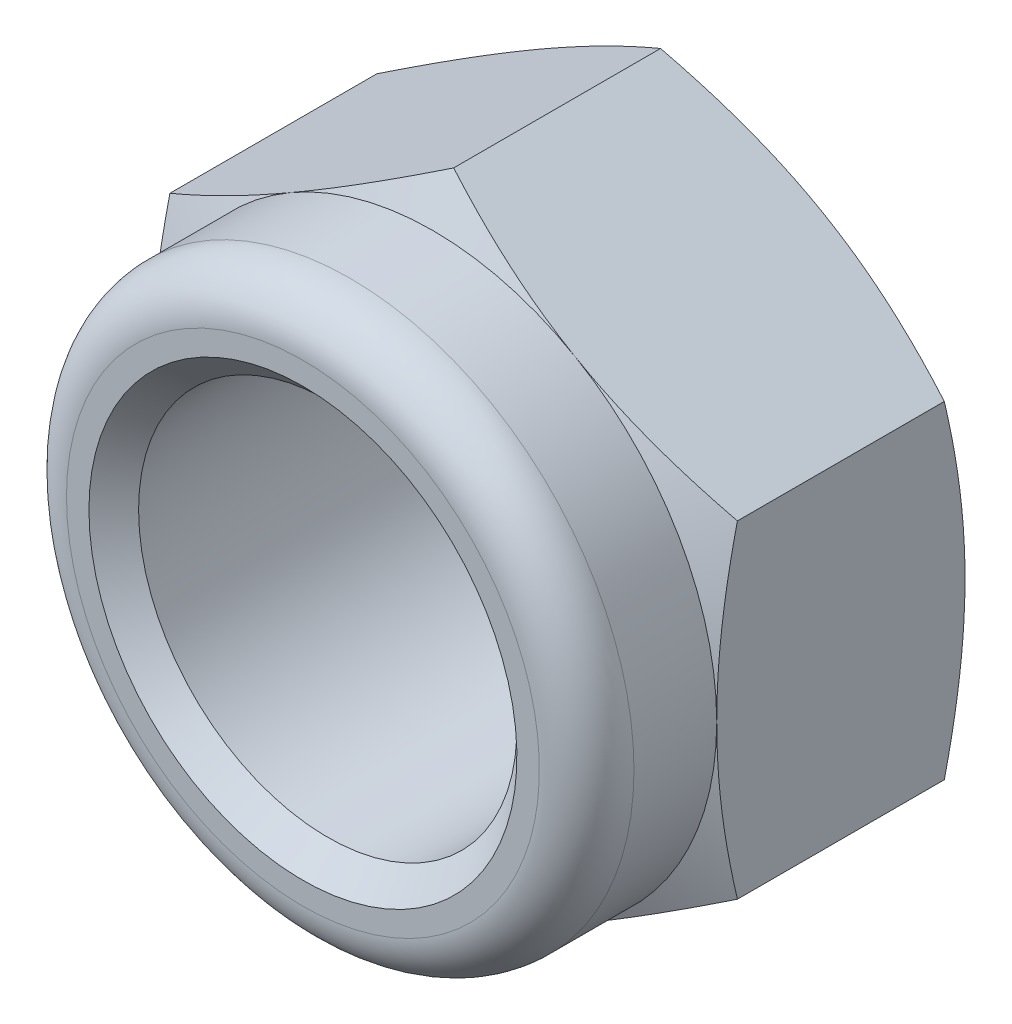
from build123d import *

# Parameters (mm, degrees)
SKETCH1_R           = 8
BOSS_EXTRUDE1_DEPTH = 10.5


with BuildPart() as part:
    # Sketch1 → Boss-Extrude1 (new body)
    with BuildSketch(Plane.XY):
        Polygon((0, -13.856406461), (12, -6.92820323), (12, 6.92820323), (0, 13.856406461), (-12, 6.92820323), (-12, -6.92820323), align=None)
        with Locations(Location((0, 0, 0), (0, 0, 180))):
            Circle(SKETCH1_R, mode=Mode.SUBTRACT)
    extrude(amount=BOSS_EXTRUDE1_DEPTH)

    # Sketch3 → Revolve1 (revolve)
    with BuildSketch(Plane(origin=(0, 0, 0), x_dir=(0, 0, -1), z_dir=(0, 1, 0))):
        with BuildLine():
            Line((-10.5, 12), (-14, 12))
            ThreePointArc((-14, 12), (-15.414213562, 11.414213562), (-16, 10))
            Line((-16, 10), (-16, 8))
            Line((-16, 8), (-10.5, 8))
            Line((-10.5, 8), (-10.5, 12))
        make_face()
    revolve(axis=Axis((0, 0, 0), (0, 0, 1)))

    # Sketch2 → Cut-Revolve1 (revolve, cut)
    with BuildSketch(Plane(origin=(0, 0, 0), x_dir=(0, 0, -1), z_dir=(1, 0, 0)), mode=Mode.PRIVATE) as cut_revolve1_sk:
        Polygon((-10.5, 13.856406461), (-10.5, 12), (-9.625, 13.856406461), align=None)
        Polygon((-0.875, 13.856406461), (0, 13.856406461), (0, 12), align=None)
        Polygon((-16, 8), (-14.95, 8), (-16, 9.05), align=None)
        Polygon((0, 8), (-1.05, 8), (0, 9.05), align=None)
    revolve(cut_revolve1_sk.sketch.rotate(Axis((0, 0, 0), (0, 0, 1)), 90), axis=Axis((0, 0, 0), (0, 0, 1)), mode=Mode.SUBTRACT)


solid = part.part
